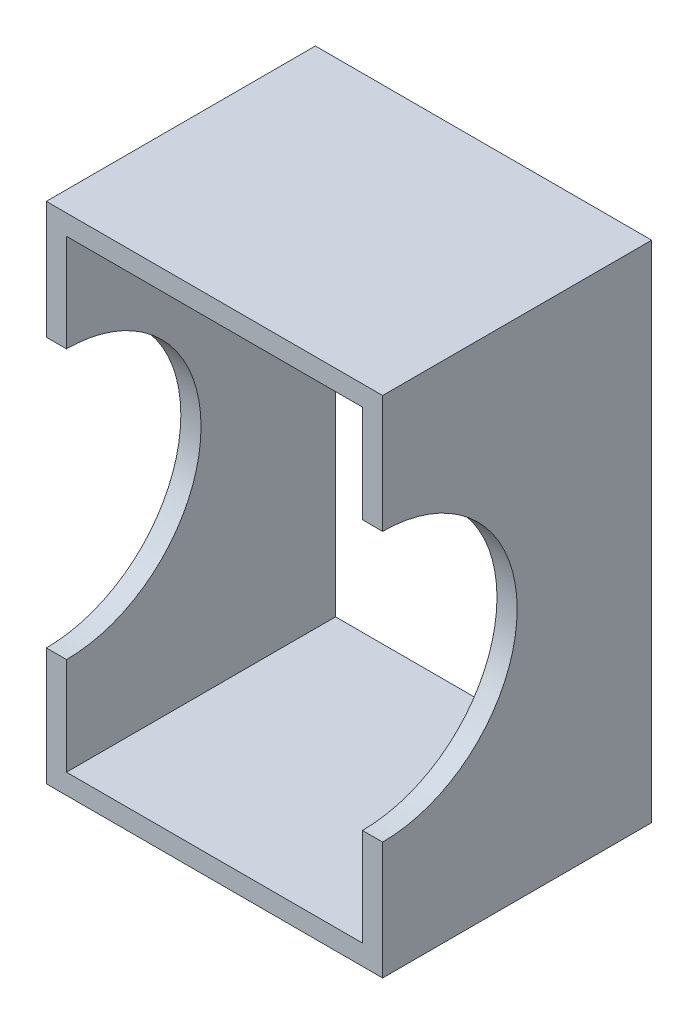
from build123d import *

# Parameters (mm, degrees)
SKETCH1_W               = 100
SKETCH1_H               = 150
SKETCH1_W_2             = 88
SKETCH1_H_2             = 138
BOSS_EXTRUDE1_DEPTH     = 80
CUT_EXTRUDE1_DEPTH      = 121.519707932
CUT_EXTRUDE1_DEPTH_BACK = 121.519707932
SKETCH2_R               = 40


with BuildPart() as part:
    # Sketch1 → Boss-Extrude1 (new body)
    with BuildSketch(Plane.XY):
        Rectangle(SKETCH1_W, SKETCH1_H)
        Rectangle(SKETCH1_W_2, SKETCH1_H_2, mode=Mode.SUBTRACT)
    extrude(amount=-BOSS_EXTRUDE1_DEPTH)

    # Sketch2 → Cut-Extrude1 (cut, two sides: drawn at the far end of the back side and taken through both)
    with BuildSketch(Plane(origin=(0, 0, 0), x_dir=(0, 0, -1), z_dir=(1, 0, 0)).offset(-CUT_EXTRUDE1_DEPTH_BACK)):
        Circle(SKETCH2_R)
    extrude(amount=CUT_EXTRUDE1_DEPTH + CUT_EXTRUDE1_DEPTH_BACK, mode=Mode.SUBTRACT)


solid = part.part
